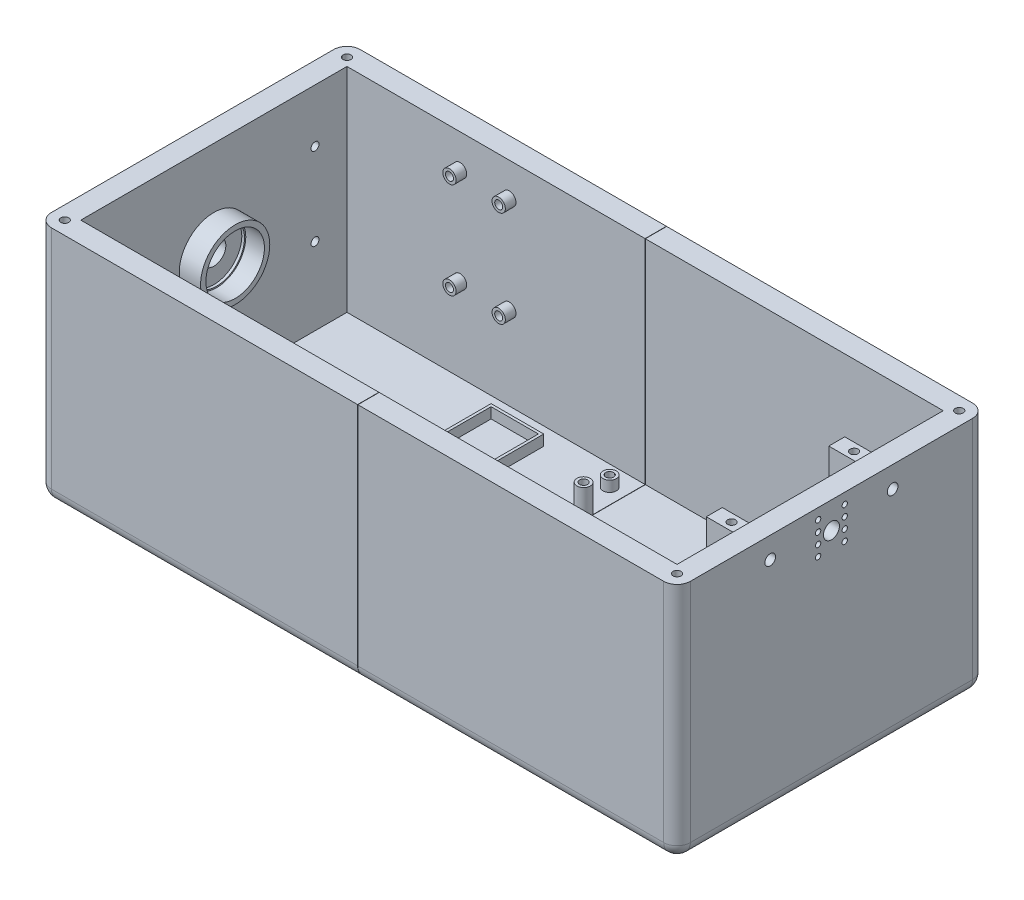
from build123d import *

# Parameters (mm, degrees)
SKETCH1_W                      = 240
SKETCH1_H                      = 116
BOSS_EXTRUDE1_DEPTH            = 10
SKETCH2_W                      = 62.15
SKETCH2_H                      = 62.15
CUT_EXTRUDE1_DEPTH             = 2.5
CUT_EXTRUDE2_REACH             = 135.493
SKETCH3_R                      = 1.5
SKETCH4_W                      = 12
SKETCH4_H                      = 15.5
CUT_EXTRUDE3_DEPTH             = 2.5
CUT_EXTRUDE4_REACH             = 135.493
SKETCH6_R                      = 1.5
CUT_EXTRUDE4_DIRECTION_2_DEPTH = 134.492509153
CUT_EXTRUDE5_REACH             = 135.493
SKETCH7_W                      = 6
SKETCH7_H                      = 15.5
SKETCH8_R                      = 2.5
SKETCH8_R_2                    = 1.5
SKETCH8_R_3                    = 2.347298944
BOSS_EXTRUDE2_DEPTH            = 15
SKETCH9_R                      = 2.5
SKETCH9_R_2                    = 1.5
SKETCH9_W                      = 19.78
SKETCH9_H                      = 34.766
SKETCH9_W_2                    = 17.78
SKETCH9_H_2                    = 32.766
BOSS_EXTRUDE3_DEPTH            = 4
SKETCH10_W                     = 240
SKETCH10_H                     = 116
SKETCH10_W_2                   = 224
SKETCH10_H_2                   = 100
BOSS_EXTRUDE4_DEPTH            = 80
CUT_EXTRUDE14_REACH            = 257.515
SKETCH24_R                     = 1.5
SKETCH14_R                     = 13
SKETCH14_R_2                   = 11
BOSS_EXTRUDE6_DEPTH            = 8
SKETCH16_R                     = 11
SKETCH16_R_2                   = 10.5
BOSS_EXTRUDE7_DEPTH            = 1
CUT_EXTRUDE9_REACH             = 257.515
SKETCH17_R                     = 4.5
SKETCH18_R                     = 2.5
SKETCH18_R_2                   = 1.5
BOSS_EXTRUDE8_DEPTH            = 4
FILLET1_R                      = 5
SKETCH19_R                     = 1.5
CUT_EXTRUDE10_DEPTH            = 20
CUT_EXTRUDE11_REACH            = 264.8
SKETCH20_R                     = 2
SKETCH21_W                     = 6
SKETCH21_H                     = 10
SKETCH21_R                     = 2
BOSS_EXTRUDE9_DEPTH            = 13
CUT_EXTRUDE12_REACH            = 161.163
SKETCH22_R                     = 1.5
CUT_EXTRUDE13_REACH            = 264.8
SKETCH23_R                     = 1
SKETCH23_R_2                   = 3
SKETCH27_W                     = 136.075180926
SKETCH27_H                     = 118.73136012
CUT_EXTRUDE15_DEPTH            = 0.1
SKETCH29_R                     = 2.25
CUT_EXTRUDE16_DEPTH            = 100


with BuildPart() as part:
    # Sketch1 → Boss-Extrude1 (new body)
    with BuildSketch(Plane(origin=(0, 0, 0), x_dir=(1, 0, 0), z_dir=(0, 1, 0))):
        Rectangle(SKETCH1_W, SKETCH1_H)
    extrude(amount=BOSS_EXTRUDE1_DEPTH)

    # Sketch2 → Cut-Extrude1 (cut)
    with BuildSketch(Plane.XZ):
        Rectangle(SKETCH2_W, SKETCH2_H)
    extrude(amount=-CUT_EXTRUDE1_DEPTH, mode=Mode.SUBTRACT)

    # Sketch3 → Cut-Extrude2 (cut, up to next)
    with BuildSketch(Plane.XZ.offset(-2.5), mode=Mode.PRIVATE) as cut_extrude2_sk1:
        with Locations(Location((-26.075, 26.075, 0), (0, 0, 270))):
            Circle(SKETCH3_R)
    cut_extrude2_tool1 = extrude(cut_extrude2_sk1.sketch, amount=-CUT_EXTRUDE2_REACH, mode=Mode.PRIVATE) & part.part
    # Sketch3 → Cut-Extrude2 (cut, up to next)
    with BuildSketch(Plane.XZ.offset(-2.5), mode=Mode.PRIVATE) as cut_extrude2_sk2:
        with Locations(Location((-26.075, -26.075, 0), (0, 0, 90))):
            Circle(SKETCH3_R)
    cut_extrude2_tool2 = extrude(cut_extrude2_sk2.sketch, amount=-CUT_EXTRUDE2_REACH, mode=Mode.PRIVATE) & part.part
    # Sketch3 → Cut-Extrude2 (cut, up to next)
    with BuildSketch(Plane.XZ.offset(-2.5), mode=Mode.PRIVATE) as cut_extrude2_sk3:
        with Locations(Location((26.075, -26.075, 0), (0, 0, 270))):
            Circle(SKETCH3_R)
    cut_extrude2_tool3 = extrude(cut_extrude2_sk3.sketch, amount=-CUT_EXTRUDE2_REACH, mode=Mode.PRIVATE) & part.part
    # Sketch3 → Cut-Extrude2 (cut, up to next)
    with BuildSketch(Plane.XZ.offset(-2.5), mode=Mode.PRIVATE) as cut_extrude2_sk4:
        with Locations(Location((26.075, 26.075, 0), (0, 0, 90))):
            Circle(SKETCH3_R)
    cut_extrude2_tool4 = extrude(cut_extrude2_sk4.sketch, amount=-CUT_EXTRUDE2_REACH, mode=Mode.PRIVATE) & part.part
    add(cut_extrude2_tool1.solids().sort_by_distance((-26.075, 2.5, 26.075))[0], mode=Mode.SUBTRACT)
    add(cut_extrude2_tool2.solids().sort_by_distance((-26.075, 2.5, -26.075))[0], mode=Mode.SUBTRACT)
    add(cut_extrude2_tool3.solids().sort_by_distance((26.075, 2.5, -26.075))[0], mode=Mode.SUBTRACT)
    add(cut_extrude2_tool4.solids().sort_by_distance((26.075, 2.5, 26.075))[0], mode=Mode.SUBTRACT)

    # Sketch4 → Cut-Extrude3 (cut)
    with BuildSketch(Plane.XZ):
        with Locations((54, 0)):
            Rectangle(SKETCH4_W, SKETCH4_H)
    extrude(amount=-CUT_EXTRUDE3_DEPTH, mode=Mode.SUBTRACT)

    # Sketch6 → Cut-Extrude4 (cut, up to next)
    with BuildSketch(Plane.XZ.offset(-2.5), mode=Mode.PRIVATE) as cut_extrude4_sk1:
        with Locations(Location((58, 5.75, 0), (0, 0, 90))):
            Circle(SKETCH6_R)
    cut_extrude4_tool1 = extrude(cut_extrude4_sk1.sketch, amount=-CUT_EXTRUDE4_REACH, mode=Mode.PRIVATE) & part.part
    # Sketch6 → Cut-Extrude4 (cut, up to next)
    with BuildSketch(Plane.XZ.offset(-2.5), mode=Mode.PRIVATE) as cut_extrude4_sk2:
        with Locations(Location((58, -5.75, 0), (0, 0, 90))):
            Circle(SKETCH6_R)
    cut_extrude4_tool2 = extrude(cut_extrude4_sk2.sketch, amount=-CUT_EXTRUDE4_REACH, mode=Mode.PRIVATE) & part.part
    add(cut_extrude4_tool1.solids().sort_by_distance((58, 2.5, 5.75))[0], mode=Mode.SUBTRACT)
    add(cut_extrude4_tool2.solids().sort_by_distance((58, 2.5, -5.75))[0], mode=Mode.SUBTRACT)

    # Sketch6 → Cut-Extrude4 direction 2 (cut)
    with BuildSketch(Plane.XZ.offset(-2.5)):
        with Locations(Location((58, 5.75, 0), (0, 0, 90))):
            Circle(SKETCH6_R)
        with Locations(Location((58, -5.75, 0), (0, 0, 90))):
            Circle(SKETCH6_R)
    extrude(amount=CUT_EXTRUDE4_DIRECTION_2_DEPTH, mode=Mode.SUBTRACT)

    # Sketch7 → Cut-Extrude5 (cut, up to next)
    with BuildSketch(Plane.XZ.offset(-2.5), mode=Mode.PRIVATE) as cut_extrude5_sk1:
        with Locations((51, 0)):
            Rectangle(SKETCH7_W, SKETCH7_H)
    cut_extrude5_tool1 = extrude(cut_extrude5_sk1.sketch, amount=-CUT_EXTRUDE5_REACH, mode=Mode.PRIVATE) & part.part
    add(cut_extrude5_tool1.solids().sort_by_distance((51, 2.5, 0))[0], mode=Mode.SUBTRACT)

    # Sketch8 → Boss-Extrude2 (add)
    # profile 1 of 4: a face of its own
    with BuildSketch(Plane(origin=(0, 10, 0), x_dir=(1, 0, 0), z_dir=(0, 1, 0))):
        with Locations(Location((86.5, 24.2, 0), (0, 0, 270))):
            Circle(SKETCH8_R)
        with Locations(Location((86.5, 24.2, 0), (0, 0, 270))):
            Circle(SKETCH8_R_2, mode=Mode.SUBTRACT)
    # profile 2 of 4: a face of its own
    with BuildSketch(Plane(origin=(0, 10, 0), x_dir=(1, 0, 0), z_dir=(0, 1, 0))):
        with Locations(Location((84.5, -24.2, 0), (0, 0, 270))):
            Circle(SKETCH8_R_3)
        with Locations(Location((84.5, -24.2, 0), (0, 0, 270))):
            Circle(SKETCH8_R_2, mode=Mode.SUBTRACT)
    # profile 3 of 4: a face of its own
    with BuildSketch(Plane(origin=(0, 10, 0), x_dir=(1, 0, 0), z_dir=(0, 1, 0))):
        with Locations(Location((9.7, -24.2, 0), (0, 0, 270))):
            Circle(SKETCH8_R)
        with Locations(Location((9.7, -24.2, 0), (0, 0, 270))):
            Circle(SKETCH8_R_2, mode=Mode.SUBTRACT)
    # profile 4 of 4: a face of its own
    with BuildSketch(Plane(origin=(0, 10, 0), x_dir=(1, 0, 0), z_dir=(0, 1, 0))):
        with Locations(Location((2.7, 24.2, 0), (0, 0, 270))):
            Circle(SKETCH8_R)
        with Locations(Location((2.7, 24.2, 0), (0, 0, 270))):
            Circle(SKETCH8_R_2, mode=Mode.SUBTRACT)
    extrude(amount=BOSS_EXTRUDE2_DEPTH)

    # Sketch9 → Boss-Extrude3 (add)
    # profile 1 of 5: a face of its own
    with BuildSketch(Plane(origin=(0, 10, 0), x_dir=(1, 0, 0), z_dir=(0, 1, 0))):
        with Locations(Location((-24.1, 15.8, 0), (0, 0, 270))):
            Circle(SKETCH9_R)
        with Locations(Location((-24.1, 15.8, 0), (0, 0, 270))):
            Circle(SKETCH9_R_2, mode=Mode.SUBTRACT)
    # profile 2 of 5: a face of its own
    with BuildSketch(Plane(origin=(0, 10, 0), x_dir=(1, 0, 0), z_dir=(0, 1, 0))):
        with Locations(Location((-5.8, 15.8, 0), (0, 0, 270))):
            Circle(SKETCH9_R)
        with Locations(Location((-5.8, 15.8, 0), (0, 0, 270))):
            Circle(SKETCH9_R_2, mode=Mode.SUBTRACT)
    # profile 3 of 5: a face of its own
    with BuildSketch(Plane(origin=(0, 10, 0), x_dir=(1, 0, 0), z_dir=(0, 1, 0))):
        with Locations(Location((-5.8, 42.5, 0), (0, 0, 270))):
            Circle(SKETCH9_R)
        with Locations(Location((-5.8, 42.5, 0), (0, 0, 270))):
            Circle(SKETCH9_R_2, mode=Mode.SUBTRACT)
    # profile 4 of 5: a face of its own
    with BuildSketch(Plane(origin=(0, 10, 0), x_dir=(1, 0, 0), z_dir=(0, 1, 0))):
        Polygon((-17.7, -47), (-17.7, -48), (-22.7, -48), (-22.7, -22.8), (-3.3, -22.8), (-3.3, -48), (-8.3, -48), (-8.3, -47), (-4.3, -47), (-4.3, -23.8), (-21.7, -23.8), (-21.7, -47), align=None)
    # profile 5 of 5: a face of its own
    with BuildSketch(Plane(origin=(0, 10, 0), x_dir=(1, 0, 0), z_dir=(0, 1, 0))):
        with Locations((-41.35, 26)):
            Rectangle(SKETCH9_W, SKETCH9_H)
        with Locations((-41.35, 26)):
            Rectangle(SKETCH9_W_2, SKETCH9_H_2, mode=Mode.SUBTRACT)
    extrude(amount=BOSS_EXTRUDE3_DEPTH)

    # Sketch10 → Boss-Extrude4 (add)
    with BuildSketch(Plane(origin=(0, 10, 0), x_dir=(1, 0, 0), z_dir=(0, 1, 0))):
        Rectangle(SKETCH10_W, SKETCH10_H)
        Rectangle(SKETCH10_W_2, SKETCH10_H_2, mode=Mode.SUBTRACT)
    extrude(amount=BOSS_EXTRUDE4_DEPTH)

    # Sketch24 → Cut-Extrude14 (cut, up to next)
    with BuildSketch(Plane(origin=(-112, 0, 0), x_dir=(0, 0, -1), z_dir=(1, 0, 0)), mode=Mode.PRIVATE) as cut_extrude14_sk1:
        with Locations((-38, 70)):
            Circle(SKETCH24_R)
    cut_extrude14_tool1 = extrude(cut_extrude14_sk1.sketch, amount=-CUT_EXTRUDE14_REACH, mode=Mode.PRIVATE) & part.part
    # Sketch24 → Cut-Extrude14 (cut, up to next)
    with BuildSketch(Plane(origin=(-112, 0, 0), x_dir=(0, 0, -1), z_dir=(1, 0, 0)), mode=Mode.PRIVATE) as cut_extrude14_sk2:
        with Locations((-38, 39)):
            Circle(SKETCH24_R)
    cut_extrude14_tool2 = extrude(cut_extrude14_sk2.sketch, amount=-CUT_EXTRUDE14_REACH, mode=Mode.PRIVATE) & part.part
    # Sketch24 → Cut-Extrude14 (cut, up to next)
    with BuildSketch(Plane(origin=(-112, 0, 0), x_dir=(0, 0, -1), z_dir=(1, 0, 0)), mode=Mode.PRIVATE) as cut_extrude14_sk3:
        with Locations((38, 39)):
            Circle(SKETCH24_R)
    cut_extrude14_tool3 = extrude(cut_extrude14_sk3.sketch, amount=-CUT_EXTRUDE14_REACH, mode=Mode.PRIVATE) & part.part
    # Sketch24 → Cut-Extrude14 (cut, up to next)
    with BuildSketch(Plane(origin=(-112, 0, 0), x_dir=(0, 0, -1), z_dir=(1, 0, 0)), mode=Mode.PRIVATE) as cut_extrude14_sk4:
        with Locations((38, 70)):
            Circle(SKETCH24_R)
    cut_extrude14_tool4 = extrude(cut_extrude14_sk4.sketch, amount=-CUT_EXTRUDE14_REACH, mode=Mode.PRIVATE) & part.part
    add(cut_extrude14_tool1.solids().sort_by_distance((-112, 70, 38))[0], mode=Mode.SUBTRACT)
    add(cut_extrude14_tool2.solids().sort_by_distance((-112, 39, 38))[0], mode=Mode.SUBTRACT)
    add(cut_extrude14_tool3.solids().sort_by_distance((-112, 39, -38))[0], mode=Mode.SUBTRACT)
    add(cut_extrude14_tool4.solids().sort_by_distance((-112, 70, -38))[0], mode=Mode.SUBTRACT)

    # Sketch14 → Boss-Extrude6 (add)
    with BuildSketch(Plane(origin=(-112, 0, 0), x_dir=(0, 0, -1), z_dir=(1, 0, 0))):
        with Locations((0, 54.5)):
            Circle(SKETCH14_R)
        with Locations((0, 54.5)):
            Circle(SKETCH14_R_2, mode=Mode.SUBTRACT)
    extrude(amount=BOSS_EXTRUDE6_DEPTH)

    # Sketch16 → Boss-Extrude7 (add)
    with BuildSketch(Plane(origin=(-112, 0, 0), x_dir=(0, 0, -1), z_dir=(1, 0, 0))):
        with Locations((0, 54.5)):
            Circle(SKETCH16_R)
        with Locations((0, 54.5)):
            Circle(SKETCH16_R_2, mode=Mode.SUBTRACT)
    extrude(amount=BOSS_EXTRUDE7_DEPTH)

    # Sketch17 → Cut-Extrude9 (cut, up to next)
    with BuildSketch(Plane(origin=(-112, 0, 0), x_dir=(0, 0, -1), z_dir=(1, 0, 0)), mode=Mode.PRIVATE) as cut_extrude9_sk1:
        with Locations((0, 54.5)):
            Circle(SKETCH17_R)
    cut_extrude9_tool1 = extrude(cut_extrude9_sk1.sketch, amount=-CUT_EXTRUDE9_REACH, mode=Mode.PRIVATE) & part.part
    add(cut_extrude9_tool1.solids().sort_by_distance((-112, 54.5, 0))[0], mode=Mode.SUBTRACT)

    # Sketch18 → Boss-Extrude8 (add)
    # profile 1 of 4: a face of its own
    with BuildSketch(Plane.XY.offset(-50)):
        with Locations((-69.5, 77.5)):
            Circle(SKETCH18_R)
        with Locations((-69.5, 77.5)):
            Circle(SKETCH18_R_2, mode=Mode.SUBTRACT)
    # profile 2 of 4: a face of its own
    with BuildSketch(Plane.XY.offset(-50)):
        with Locations(Location((-69.5, 41.351210886, 0), (0, 0, 180))):
            Circle(SKETCH18_R)
        with Locations(Location((-69.5, 41.351210886, 0), (0, 0, 180))):
            Circle(SKETCH18_R_2, mode=Mode.SUBTRACT)
    # profile 3 of 4: a face of its own
    with BuildSketch(Plane.XY.offset(-50)):
        with Locations((-51, 41.351210886)):
            Circle(SKETCH18_R)
        with Locations((-51, 41.351210886)):
            Circle(SKETCH18_R_2, mode=Mode.SUBTRACT)
    # profile 4 of 4: a face of its own
    with BuildSketch(Plane.XY.offset(-50)):
        with Locations(Location((-51, 77.5, 0), (0, 0, 180))):
            Circle(SKETCH18_R)
        with Locations(Location((-51, 77.5, 0), (0, 0, 180))):
            Circle(SKETCH18_R_2, mode=Mode.SUBTRACT)
    extrude(amount=BOSS_EXTRUDE8_DEPTH)

    # Fillet1
    fillet1_edges = [part.edges().sort_by_distance(p)[0] for p in [
        (0, 0, 58),
        (-120, 0, 0),
        (0, 0, -58),
        (120, 0, 0),
        (120, 45, 58),
        (-120, 45, 58),
        (-120, 45, -58),
        (120, 45, -58),
    ]]
    fillet(fillet1_edges, radius=FILLET1_R)

    # Sketch19 → Cut-Extrude10 (cut)
    with BuildSketch(Plane(origin=(0, 90, 0), x_dir=(1, 0, 0), z_dir=(0, 1, 0))):
        with Locations(Location((115, 53, 0), (0, 0, 270))):
            Circle(SKETCH19_R)
        with Locations(Location((-115, 53, 0), (0, 0, 270))):
            Circle(SKETCH19_R)
        with Locations(Location((-115, -53, 0), (0, 0, 270))):
            Circle(SKETCH19_R)
        with Locations(Location((115, -53, 0), (0, 0, 270))):
            Circle(SKETCH19_R)
    extrude(amount=-CUT_EXTRUDE10_DEPTH, mode=Mode.SUBTRACT)

    # Sketch20 → Cut-Extrude11 (cut, up to next)
    with BuildSketch(Plane(origin=(120, 0, 0), x_dir=(0, 0, -1), z_dir=(1, 0, 0)), mode=Mode.PRIVATE) as cut_extrude11_sk1:
        with Locations((-23, 82)):
            Circle(SKETCH20_R)
    cut_extrude11_tool1 = extrude(cut_extrude11_sk1.sketch, amount=-CUT_EXTRUDE11_REACH, mode=Mode.PRIVATE) & part.part
    # Sketch20 → Cut-Extrude11 (cut, up to next)
    with BuildSketch(Plane(origin=(120, 0, 0), x_dir=(0, 0, -1), z_dir=(1, 0, 0)), mode=Mode.PRIVATE) as cut_extrude11_sk2:
        with Locations(Location((23, 82, 0), (0, 0, 180))):
            Circle(SKETCH20_R)
    cut_extrude11_tool2 = extrude(cut_extrude11_sk2.sketch, amount=-CUT_EXTRUDE11_REACH, mode=Mode.PRIVATE) & part.part
    add(cut_extrude11_tool1.solids().sort_by_distance((120, 82, 23))[0], mode=Mode.SUBTRACT)
    add(cut_extrude11_tool2.solids().sort_by_distance((120, 82, -23))[0], mode=Mode.SUBTRACT)

    # Sketch21 → Boss-Extrude9 (add)
    # profile 1 of 2: a face of its own
    with BuildSketch(Plane.ZY.offset(-112)):
        with Locations((-23, 82)):
            Rectangle(SKETCH21_W, SKETCH21_H)
        with Locations((-23, 82)):
            Circle(SKETCH21_R, mode=Mode.SUBTRACT)
    # profile 2 of 2: a face of its own
    with BuildSketch(Plane.ZY.offset(-112)):
        with Locations((23, 82)):
            Rectangle(SKETCH21_W, SKETCH21_H)
        with Locations(Location((23, 82, 0), (0, 0, 180))):
            Circle(SKETCH21_R, mode=Mode.SUBTRACT)
    extrude(amount=BOSS_EXTRUDE9_DEPTH)

    # Sketch22 → Cut-Extrude12 (cut, up to next)
    with BuildSketch(Plane(origin=(0, 87, 0), x_dir=(1, 0, 0), z_dir=(0, 1, 0)), mode=Mode.PRIVATE) as cut_extrude12_sk1:
        with Locations(Location((105.5, -23, 0), (0, 0, 270))):
            Circle(SKETCH22_R)
    cut_extrude12_tool1 = extrude(cut_extrude12_sk1.sketch, amount=-CUT_EXTRUDE12_REACH, mode=Mode.PRIVATE) & part.part
    # Sketch22 → Cut-Extrude12 (cut, up to next)
    with BuildSketch(Plane(origin=(0, 87, 0), x_dir=(1, 0, 0), z_dir=(0, 1, 0)), mode=Mode.PRIVATE) as cut_extrude12_sk2:
        with Locations(Location((105.5, 23, 0), (0, 0, 270))):
            Circle(SKETCH22_R)
    cut_extrude12_tool2 = extrude(cut_extrude12_sk2.sketch, amount=-CUT_EXTRUDE12_REACH, mode=Mode.PRIVATE) & part.part
    add(cut_extrude12_tool1.solids().sort_by_distance((105.5, 87, 23))[0], mode=Mode.SUBTRACT)
    add(cut_extrude12_tool2.solids().sort_by_distance((105.5, 87, -23))[0], mode=Mode.SUBTRACT)

    # Sketch23 → Cut-Extrude13 (cut, up to next)
    with BuildSketch(Plane(origin=(120, 0, 0), x_dir=(0, 0, -1), z_dir=(1, 0, 0)), mode=Mode.PRIVATE) as cut_extrude13_sk1:
        with Locations((5, 78)):
            Circle(SKETCH23_R)
    cut_extrude13_tool1 = extrude(cut_extrude13_sk1.sketch, amount=-CUT_EXTRUDE13_REACH, mode=Mode.PRIVATE) & part.part
    # Sketch23 → Cut-Extrude13 (cut, up to next)
    with BuildSketch(Plane(origin=(120, 0, 0), x_dir=(0, 0, -1), z_dir=(1, 0, 0)), mode=Mode.PRIVATE) as cut_extrude13_sk2:
        with Locations((-5, 78)):
            Circle(SKETCH23_R)
    cut_extrude13_tool2 = extrude(cut_extrude13_sk2.sketch, amount=-CUT_EXTRUDE13_REACH, mode=Mode.PRIVATE) & part.part
    # Sketch23 → Cut-Extrude13 (cut, up to next)
    with BuildSketch(Plane(origin=(120, 0, 0), x_dir=(0, 0, -1), z_dir=(1, 0, 0)), mode=Mode.PRIVATE) as cut_extrude13_sk3:
        with Locations((5, 74)):
            Circle(SKETCH23_R)
    cut_extrude13_tool3 = extrude(cut_extrude13_sk3.sketch, amount=-CUT_EXTRUDE13_REACH, mode=Mode.PRIVATE) & part.part
    # Sketch23 → Cut-Extrude13 (cut, up to next)
    with BuildSketch(Plane(origin=(120, 0, 0), x_dir=(0, 0, -1), z_dir=(1, 0, 0)), mode=Mode.PRIVATE) as cut_extrude13_sk4:
        with Locations((-5, 74)):
            Circle(SKETCH23_R)
    cut_extrude13_tool4 = extrude(cut_extrude13_sk4.sketch, amount=-CUT_EXTRUDE13_REACH, mode=Mode.PRIVATE) & part.part
    # Sketch23 → Cut-Extrude13 (cut, up to next)
    with BuildSketch(Plane(origin=(120, 0, 0), x_dir=(0, 0, -1), z_dir=(1, 0, 0)), mode=Mode.PRIVATE) as cut_extrude13_sk5:
        with Locations(Location((-5, 86, 0), (0, 0, 180))):
            Circle(SKETCH23_R)
    cut_extrude13_tool5 = extrude(cut_extrude13_sk5.sketch, amount=-CUT_EXTRUDE13_REACH, mode=Mode.PRIVATE) & part.part
    # Sketch23 → Cut-Extrude13 (cut, up to next)
    with BuildSketch(Plane(origin=(120, 0, 0), x_dir=(0, 0, -1), z_dir=(1, 0, 0)), mode=Mode.PRIVATE) as cut_extrude13_sk6:
        with Locations(Location((5, 86, 0), (0, 0, 180))):
            Circle(SKETCH23_R)
    cut_extrude13_tool6 = extrude(cut_extrude13_sk6.sketch, amount=-CUT_EXTRUDE13_REACH, mode=Mode.PRIVATE) & part.part
    # Sketch23 → Cut-Extrude13 (cut, up to next)
    with BuildSketch(Plane(origin=(120, 0, 0), x_dir=(0, 0, -1), z_dir=(1, 0, 0)), mode=Mode.PRIVATE) as cut_extrude13_sk7:
        with Locations(Location((-5, 82, 0), (0, 0, 180))):
            Circle(SKETCH23_R)
    cut_extrude13_tool7 = extrude(cut_extrude13_sk7.sketch, amount=-CUT_EXTRUDE13_REACH, mode=Mode.PRIVATE) & part.part
    # Sketch23 → Cut-Extrude13 (cut, up to next)
    with BuildSketch(Plane(origin=(120, 0, 0), x_dir=(0, 0, -1), z_dir=(1, 0, 0)), mode=Mode.PRIVATE) as cut_extrude13_sk8:
        with Locations(Location((5, 82, 0), (0, 0, 180))):
            Circle(SKETCH23_R)
    cut_extrude13_tool8 = extrude(cut_extrude13_sk8.sketch, amount=-CUT_EXTRUDE13_REACH, mode=Mode.PRIVATE) & part.part
    # Sketch23 → Cut-Extrude13 (cut, up to next)
    with BuildSketch(Plane(origin=(120, 0, 0), x_dir=(0, 0, -1), z_dir=(1, 0, 0)), mode=Mode.PRIVATE) as cut_extrude13_sk9:
        with Locations((0, 80)):
            Circle(SKETCH23_R_2)
    cut_extrude13_tool9 = extrude(cut_extrude13_sk9.sketch, amount=-CUT_EXTRUDE13_REACH, mode=Mode.PRIVATE) & part.part
    add(cut_extrude13_tool1.solids().sort_by_distance((120, 78, -5))[0], mode=Mode.SUBTRACT)
    add(cut_extrude13_tool2.solids().sort_by_distance((120, 78, 5))[0], mode=Mode.SUBTRACT)
    add(cut_extrude13_tool3.solids().sort_by_distance((120, 74, -5))[0], mode=Mode.SUBTRACT)
    add(cut_extrude13_tool4.solids().sort_by_distance((120, 74, 5))[0], mode=Mode.SUBTRACT)
    add(cut_extrude13_tool5.solids().sort_by_distance((120, 86, 5))[0], mode=Mode.SUBTRACT)
    add(cut_extrude13_tool6.solids().sort_by_distance((120, 86, -5))[0], mode=Mode.SUBTRACT)
    add(cut_extrude13_tool7.solids().sort_by_distance((120, 82, 5))[0], mode=Mode.SUBTRACT)
    add(cut_extrude13_tool8.solids().sort_by_distance((120, 82, -5))[0], mode=Mode.SUBTRACT)
    add(cut_extrude13_tool9.solids().sort_by_distance((120, 80, 0))[0], mode=Mode.SUBTRACT)

    # Sketch27 → Cut-Extrude15 (cut)
    with BuildSketch(Plane.ZY):
        with Locations((0, 54.5)):
            Rectangle(SKETCH27_W, SKETCH27_H)
    extrude(amount=-CUT_EXTRUDE15_DEPTH, mode=Mode.SUBTRACT)


with BuildPart() as cut_extrude15_piece_1:
    # of the separate pieces the step leaves, piece 1, a body of its own (cut_extrude15_pieces)
    add(part.part.solids().sort_by_distance((-115, 5, -58))[0])


with BuildPart() as cut_extrude15_piece_2:
    # of the separate pieces the step leaves, piece 2, a body of its own (cut_extrude15_pieces)
    add(part.part.solids().sort_by_distance((0.1, 90, -58))[0])

    # Sketch29 → Cut-Extrude16 (cut)
    with BuildSketch(Plane.ZY.offset(-0.1)):
        with Locations((-48, 4)):
            Circle(SKETCH29_R)
        with Locations((48, 4)):
            Circle(SKETCH29_R)
    extrude(amount=-CUT_EXTRUDE16_DEPTH, mode=Mode.SUBTRACT)


solid = Compound([cut_extrude15_piece_1.part, cut_extrude15_piece_2.part])
